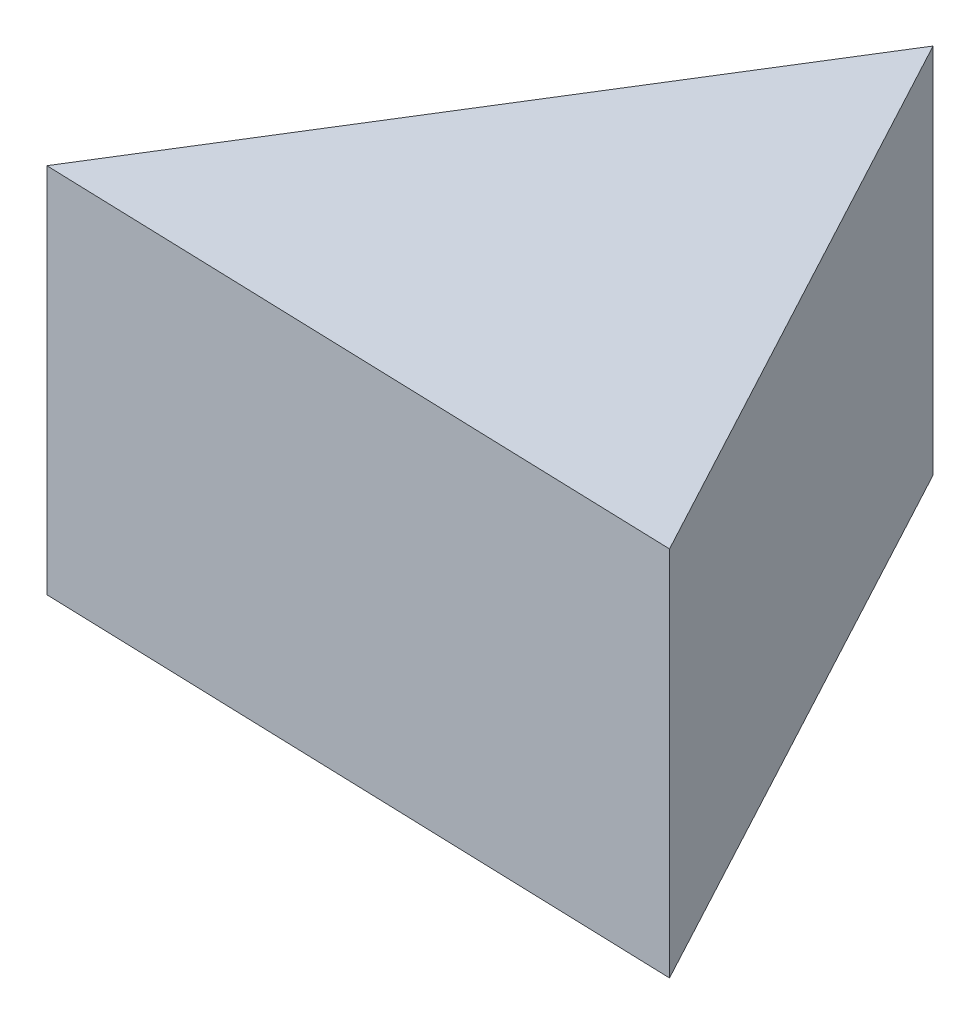
from build123d import *

# Parameters (mm, degrees)
BOSS_EXTRUDE1_DEPTH = 20


with BuildPart() as part:
    # Sketch1 → Boss-Extrude1 (new body)
    with BuildSketch(Plane(origin=(0, 0, 0), x_dir=(1, 0, 0), z_dir=(0, 1, 0))):
        Polygon((-19.6054162, 0), (-35.956252029, 30.539321664), (-54.22866249, 1.10942163), align=None)
    extrude(amount=-BOSS_EXTRUDE1_DEPTH)


solid = part.part
